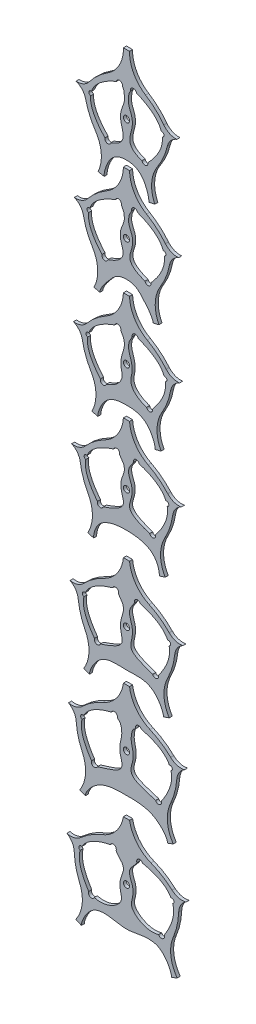
from build123d import *

# Parameters (mm, degrees)
SKETCH1_R        = 2.54
EXTRUDE1_DEPTH   = 2.54
EXTRUDE1_2_DEPTH = 2.54
EXTRUDE1_3_DEPTH = 2.54
EXTRUDE1_4_DEPTH = 2.54
EXTRUDE1_5_DEPTH = 2.54
EXTRUDE1_6_DEPTH = 2.54
EXTRUDE1_7_DEPTH = 2.54


with BuildPart() as part:
    # Sketch1 → Extrude1 (new body)
    with BuildSketch(Plane.XY):
        with BuildLine():
            Line((107.832128909, 1.131393568), (112.80266244, 2.180296049))
            ThreePointArc((112.80266244, 2.180296049), (110.202439892, 16.465021349), (114.978784208, 30.176369538))
            ThreePointArc((114.978784208, 30.176369538), (119.931057181, 39.205187012), (123.16449007, 48.982173475))
            ThreePointArc((123.16449007, 48.982173475), (125.98573059, 54.438433103), (131.070292672, 57.884792869))
            ThreePointArc((131.070292672, 57.884792869), (125.026748215, 58.982853705), (120.241431843, 62.833946332))
            ThreePointArc((120.241431843, 62.833946332), (113.333256734, 70.470808856), (105.155100681, 76.728789053))
            ThreePointArc((105.155100681, 76.728789053), (95.245871811, 87.341127032), (91.852567934, 101.458493039))
            Line((91.852567934, 101.458493039), (86.772567934, 101.458493039))
            ThreePointArc((86.772567934, 101.458493039), (83.379264056, 87.341127032), (73.470035186, 76.728789053))
            ThreePointArc((73.470035186, 76.728789053), (65.291879133, 70.470808856), (58.383704024, 62.833946332))
            ThreePointArc((58.383704024, 62.833946332), (53.598387652, 58.982853705), (47.554843195, 57.884792869))
            ThreePointArc((47.554843195, 57.884792869), (52.639405277, 54.438433103), (55.460645797, 48.982173475))
            ThreePointArc((55.460645797, 48.982173475), (58.694078686, 39.205187012), (63.646351659, 30.176369538))
            ThreePointArc((63.646351659, 30.176369538), (68.422695975, 16.465021349), (65.822473427, 2.180296049))
            Line((65.822473427, 2.180296049), (70.793006958, 1.131393568))
            add(Edge.make_bspline(
                [(70.793006958, 1.131393568), (70.520166152, 3.921097352), (74.091504837, 16.648822389), (82.215229208, 22.274663695), (89.312567934, 22.088090389)],
                knots=[0, 0, 0, 0, 0.457135888, 1, 1, 1, 1], degree=3))
            add(Edge.make_bspline(
                [(107.832128909, 1.131393568), (108.104969715, 3.921097352), (104.53363103, 16.648822389), (96.409906659, 22.274663695), (89.312567934, 22.088090389)],
                knots=[0, 0, 0, 0, 0.457135888, 1, 1, 1, 1], degree=3))
        make_face()
        with BuildLine():
            ThreePointArc((59.637889432, 53.452923121), (58.209567442, 55.601544434), (60.331376363, 57.069401428))
            Line((60.331376363, 57.069401428), (60.398343732, 57.056559931))
            add(Edge.make_bspline(
                [(60.398343732, 57.056559931), (63.674328618, 67.194658752), (81.048232702, 74.450161835)],
                knots=[0, 0, 0, 1, 1, 1], degree=2))
            ThreePointArc((81.048232702, 74.450161835), (84.057950708, 76.41097736), (86.018766233, 73.401259354))
            add(Edge.make_bspline(
                [(86.018766233, 73.401259354), (87.907895139, 69.875806798), (87.224438312, 69.342686057), (88.021949574, 59.936223688), (81.811165872, 54.675976641), (87.835939676, 37.343411453), (85.112897294, 31.001956272), (76.469615876, 28.149796174)],
                knots=[0, 0, 0, 0, 0.293254115, 0.36917198, 0.759178644, 0.846961781, 1, 1, 1, 1], degree=3))
            ThreePointArc((76.469615876, 28.149796174), (73.45989787, 26.18898065), (71.499082345, 29.198698656))
            add(Edge.make_bspline(
                [(59.637889432, 53.452923121), (58.538194712, 42.855574575), (71.499082345, 29.198698656)],
                knots=[0, 0, 0, 1, 1, 1], degree=2))
        make_face(mode=Mode.SUBTRACT)
        with Locations((89.312567934, 51.546331462)):
            Circle(SKETCH1_R, mode=Mode.SUBTRACT)
        with BuildLine():
            Line((118.226792135, 57.056559931), (118.293759504, 57.069401428))
            ThreePointArc((118.293759504, 57.069401428), (120.415568425, 55.601544434), (118.987246435, 53.452923121))
            add(Edge.make_bspline(
                [(118.987246435, 53.452923121), (120.086941155, 42.855574575), (107.126053522, 29.198698656)],
                knots=[0, 0, 0, 1, 1, 1], degree=2))
            ThreePointArc((107.126053522, 29.198698656), (105.165237997, 26.18898065), (102.155519991, 28.149796174))
            add(Edge.make_bspline(
                [(92.606369634, 73.401259354), (90.717240728, 69.875806798), (91.400697555, 69.342686057), (90.603186293, 59.936223688), (96.813969995, 54.675976641), (90.789196191, 37.343411453), (93.512238573, 31.001956272), (102.155519991, 28.149796174)],
                knots=[0, 0, 0, 0, 0.293254115, 0.36917198, 0.759178644, 0.846961781, 1, 1, 1, 1], degree=3))
            ThreePointArc((92.606369634, 73.401259354), (94.567185159, 76.41097736), (97.576903165, 74.450161835))
            add(Edge.make_bspline(
                [(118.226792135, 57.056559931), (114.950807249, 67.194658752), (97.576903165, 74.450161835)],
                knots=[0, 0, 0, 1, 1, 1], degree=2))
        make_face(mode=Mode.SUBTRACT)
    extrude(amount=EXTRUDE1_DEPTH)


with BuildPart() as body_2:
    # Sketch1 → Extrude1 2 (new body)
    with BuildSketch(Plane.XY):
        with BuildLine():
            Line((111.317801955, -83.801898793), (116.248774396, -82.580460794))
            ThreePointArc((116.248774396, -82.580460794), (113.152453729, -68.394998781), (117.448198024, -54.525567821))
            ThreePointArc((117.448198024, -54.525567821), (122.08290251, -45.329695547), (124.973744359, -35.445992498))
            ThreePointArc((124.973744359, -35.445992498), (127.603177249, -29.894753909), (132.564582131, -26.273341368))
            ThreePointArc((132.564582131, -26.273341368), (126.486450449, -25.386502911), (121.569867972, -21.704467611))
            ThreePointArc((121.569867972, -21.704467611), (114.399820133, -14.312920646), (106.008602299, -8.34366476))
            ThreePointArc((106.008602299, -8.34366476), (95.735657697, 1.916995227), (91.852567934, 15.907568771))
            Line((91.852567934, 15.907568771), (86.772567934, 15.907568771))
            ThreePointArc((86.772567934, 15.907568771), (82.88947817, 1.916995227), (72.616533568, -8.34366476))
            ThreePointArc((72.616533568, -8.34366476), (64.225315734, -14.312920646), (57.055267895, -21.704467611))
            ThreePointArc((57.055267895, -21.704467611), (52.138685418, -25.386502911), (46.060553736, -26.273341368))
            ThreePointArc((46.060553736, -26.273341368), (51.021958618, -29.894753909), (53.651391508, -35.445992498))
            ThreePointArc((53.651391508, -35.445992498), (56.542233357, -45.329695547), (61.176937843, -54.525567821))
            ThreePointArc((61.176937843, -54.525567821), (65.472682138, -68.394998781), (62.376361471, -82.580460794))
            Line((62.376361471, -82.580460794), (67.307333912, -83.801898793))
            add(Edge.make_bspline(
                [(67.307333912, -83.801898793), (67.034493107, -81.012195009), (76.161181326, -69.268831123), (82.215229208, -63.276260573), (89.312567934, -63.462833879)],
                knots=[0, 0, 0, 0, 0.457135888, 1, 1, 1, 1], degree=3))
            add(Edge.make_bspline(
                [(111.317801955, -83.801898793), (111.59064276, -81.012195009), (102.463954541, -69.268831123), (96.409906659, -63.276260573), (89.312567934, -63.462833879)],
                knots=[0, 0, 0, 0, 0.457135888, 1, 1, 1, 1], degree=3))
        make_face()
        with BuildLine():
            ThreePointArc((57.981859116, -31.123491246), (56.629261739, -28.926411915), (58.800922347, -27.533369397))
            Line((58.800922347, -27.533369397), (58.867401666, -27.548536227))
            add(Edge.make_bspline(
                [(58.867401666, -27.548536227), (62.494606868, -17.53072673), (80.110743569, -10.884931381)],
                knots=[0, 0, 0, 1, 1, 1], degree=2))
            ThreePointArc((80.110743569, -10.884931381), (83.186948789, -9.03016416), (85.04171601, -12.10636938))
            add(Edge.make_bspline(
                [(85.04171601, -12.10636938), (86.930844917, -15.631821935), (87.288646986, -16.209612947), (87.954533792, -25.614071063), (81.145621359, -30.768735871), (88.454678543, -48.305670405), (82.565093241, -54.14551048), (73.921811823, -56.997670578)],
                knots=[0, 0, 0, 0, 0.293254115, 0.36917198, 0.759178644, 0.846961781, 1, 1, 1, 1], degree=3))
            ThreePointArc((73.921811823, -56.997670578), (70.845606603, -58.852437799), (68.990839382, -55.776232579))
            add(Edge.make_bspline(
                [(57.981859116, -31.123491246), (56.513622718, -41.676093132), (68.990839382, -55.776232579)],
                knots=[0, 0, 0, 1, 1, 1], degree=2))
        make_face(mode=Mode.SUBTRACT)
        with Locations((89.312567934, -34.004592806)):
            Circle(SKETCH1_R, mode=Mode.SUBTRACT)
        with BuildLine():
            Line((119.757734201, -27.548536227), (119.82421352, -27.533369397))
            ThreePointArc((119.82421352, -27.533369397), (121.995874128, -28.926411915), (120.643276751, -31.123491246))
            add(Edge.make_bspline(
                [(120.643276751, -31.123491246), (122.111513149, -41.676093132), (109.634296485, -55.776232579)],
                knots=[0, 0, 0, 1, 1, 1], degree=2))
            ThreePointArc((109.634296485, -55.776232579), (107.779529264, -58.852437799), (104.703324044, -56.997670578))
            add(Edge.make_bspline(
                [(93.583419857, -12.10636938), (91.69429095, -15.631821935), (91.336488881, -16.209612947), (90.670602075, -25.614071063), (97.479514508, -30.768735871), (90.170457324, -48.305670405), (96.060042626, -54.14551048), (104.703324044, -56.997670578)],
                knots=[0, 0, 0, 0, 0.293254115, 0.36917198, 0.759178644, 0.846961781, 1, 1, 1, 1], degree=3))
            ThreePointArc((93.583419857, -12.10636938), (95.438187078, -9.03016416), (98.514392298, -10.884931381))
            add(Edge.make_bspline(
                [(119.757734201, -27.548536227), (116.130528999, -17.53072673), (98.514392298, -10.884931381)],
                knots=[0, 0, 0, 1, 1, 1], degree=2))
        make_face(mode=Mode.SUBTRACT)
    extrude(amount=EXTRUDE1_2_DEPTH)


with BuildPart() as body_3:
    # Sketch1 → Extrude1 3 (new body)
    with BuildSketch(Plane.XY):
        with BuildLine():
            Line((113.055007459, -173.708992761), (117.963911856, -172.401683458))
            ThreePointArc((117.963911856, -172.401683458), (114.620492326, -158.272420207), (118.673527412, -144.330130553))
            ThreePointArc((118.673527412, -144.330130553), (123.147035909, -135.054772108), (125.864943067, -125.122122248))
            ThreePointArc((125.864943067, -125.122122248), (128.397093009, -119.525839208), (133.294539882, -115.818389771))
            ThreePointArc((133.294539882, -115.818389771), (127.201856463, -115.037764409), (122.221762429, -111.442096096))
            ThreePointArc((122.221762429, -111.442096096), (114.923806341, -104.176809489), (106.429688651, -98.354909694))
            ThreePointArc((106.429688651, -98.354909694), (95.979235459, -88.275100059), (91.852567934, -74.354426608))
            Line((91.852567934, -74.354426608), (86.772567934, -74.354426608))
            ThreePointArc((86.772567934, -74.354426608), (82.645900408, -88.275100059), (72.195447216, -98.354909694))
            ThreePointArc((72.195447216, -98.354909694), (63.701329526, -104.176809489), (56.403373438, -111.442096096))
            ThreePointArc((56.403373438, -111.442096096), (51.423279404, -115.037764409), (45.330595985, -115.818389771))
            ThreePointArc((45.330595985, -115.818389771), (50.228042858, -119.525839208), (52.7601928, -125.122122248))
            ThreePointArc((52.7601928, -125.122122248), (55.478099958, -135.054772108), (59.951608455, -144.330130553))
            ThreePointArc((59.951608455, -144.330130553), (64.004643541, -158.272420207), (60.661224011, -172.401683458))
            Line((60.661224011, -172.401683458), (65.570128408, -173.708992761))
            add(Edge.make_bspline(
                [(65.570128408, -173.708992761), (65.297287603, -170.919288977), (70.669566244, -156.160043966), (82.215229208, -153.538255952), (89.312567934, -153.724829258)],
                knots=[0, 0, 0, 0, 0.457135888, 1, 1, 1, 1], degree=3))
            add(Edge.make_bspline(
                [(113.055007459, -173.708992761), (113.327848264, -170.919288977), (107.955569623, -156.160043966), (96.409906659, -153.538255952), (89.312567934, -153.724829258)],
                knots=[0, 0, 0, 0, 0.457135888, 1, 1, 1, 1], degree=3))
        make_face()
        with BuildLine():
            ThreePointArc((57.165438906, -120.875856415), (55.851391857, -118.655505631), (58.047033655, -117.300575983))
            Line((58.047033655, -117.300575983), (58.113238151, -117.316900727))
            add(Edge.make_bspline(
                [(58.113238151, -117.316900727), (61.914725796, -107.363920451), (79.644164595, -101.026581266)],
                knots=[0, 0, 0, 1, 1, 1], degree=2))
            ThreePointArc((79.644164595, -101.026581266), (82.752271446, -99.225783719), (84.553068993, -102.333890569))
            add(Edge.make_bspline(
                [(84.553068993, -102.333890569), (86.442197899, -105.859343124), (87.355553475, -106.512811497), (87.865027924, -115.811254425), (82.628053526, -123.038711024), (87.090334203, -136.716381264), (81.294678605, -144.172125419), (72.651397187, -147.024285517)],
                knots=[0, 0, 0, 0, 0.293254115, 0.36917198, 0.759178644, 0.846961781, 1, 1, 1, 1], degree=3))
            ThreePointArc((72.651397187, -147.024285517), (69.543290336, -148.825083064), (67.742492789, -145.716976214))
            add(Edge.make_bspline(
                [(57.165438906, -120.875856415), (55.51325783, -131.40122683), (67.742492789, -145.716976214)],
                knots=[0, 0, 0, 1, 1, 1], degree=2))
        make_face(mode=Mode.SUBTRACT)
        with Locations((89.312567934, -124.266588185)):
            Circle(SKETCH1_R, mode=Mode.SUBTRACT)
        with BuildLine():
            Line((120.511897716, -117.316900727), (120.578102212, -117.300575983))
            ThreePointArc((120.578102212, -117.300575983), (122.77374401, -118.655505631), (121.459696961, -120.875856415))
            add(Edge.make_bspline(
                [(121.459696961, -120.875856415), (123.111878037, -131.40122683), (110.882643078, -145.716976214)],
                knots=[0, 0, 0, 1, 1, 1], degree=2))
            ThreePointArc((110.882643078, -145.716976214), (109.081845531, -148.825083064), (105.97373868, -147.024285517))
            add(Edge.make_bspline(
                [(94.072066874, -102.333890569), (92.182937968, -105.859343124), (91.269582392, -106.512811497), (90.760107943, -115.811254425), (95.997082341, -123.038711024), (91.534801664, -136.716381264), (97.330457262, -144.172125419), (105.97373868, -147.024285517)],
                knots=[0, 0, 0, 0, 0.293254115, 0.36917198, 0.759178644, 0.846961781, 1, 1, 1, 1], degree=3))
            ThreePointArc((94.072066874, -102.333890569), (95.872864421, -99.225783719), (98.980971272, -101.026581266))
            add(Edge.make_bspline(
                [(120.511897716, -117.316900727), (116.710410071, -107.363920451), (98.980971272, -101.026581266)],
                knots=[0, 0, 0, 1, 1, 1], degree=2))
        make_face(mode=Mode.SUBTRACT)
    extrude(amount=EXTRUDE1_3_DEPTH)


with BuildPart() as body_4:
    # Sketch1 → Extrude1 4 (new body)
    with BuildSketch(Plane.XY):
        with BuildLine():
            Line((116.503626903, -262.696328621), (121.364004788, -261.218787822))
            ThreePointArc((121.364004788, -261.218787822), (117.53035459, -247.214586298), (121.095182818, -233.13955401))
            ThreePointArc((121.095182818, -233.13955401), (125.242824049, -223.713970486), (127.613029858, -213.692659345))
            ThreePointArc((127.613029858, -213.692659345), (129.94866929, -208.011554202), (134.713976252, -204.135729547))
            ThreePointArc((134.713976252, -204.135729547), (128.597794821, -203.567845844), (123.495451856, -200.147865804))
            ThreePointArc((123.495451856, -200.147865804), (115.948805294, -193.141249058), (107.257010585, -187.618816868))
            ThreePointArc((107.257010585, -187.618816868), (96.461723403, -177.909218069), (91.852567934, -164.1407679))
            Line((91.852567934, -164.1407679), (86.772567934, -164.1407679))
            ThreePointArc((86.772567934, -164.1407679), (82.163412464, -177.909218069), (71.368125282, -187.618816868))
            ThreePointArc((71.368125282, -187.618816868), (62.676330573, -193.141249058), (55.129684011, -200.147865804))
            ThreePointArc((55.129684011, -200.147865804), (50.027341046, -203.567845844), (43.911159615, -204.135729547))
            ThreePointArc((43.911159615, -204.135729547), (48.676466577, -208.011554202), (51.012106009, -213.692659345))
            ThreePointArc((51.012106009, -213.692659345), (53.382311818, -223.713970486), (57.529953049, -233.13955401))
            ThreePointArc((57.529953049, -233.13955401), (61.094781277, -247.214586298), (57.261131079, -261.218787822))
            Line((57.261131079, -261.218787822), (62.121508964, -262.696328621))
            add(Edge.make_bspline(
                [(62.121508964, -262.696328621), (61.848668159, -259.906624837), (65.058750413, -245.89938072), (82.215229208, -243.324597244), (89.312567934, -243.51117055)],
                knots=[0, 0, 0, 0, 0.457135888, 1, 1, 1, 1], degree=3))
            add(Edge.make_bspline(
                [(116.503626903, -262.696328621), (116.776467708, -259.906624837), (113.566385454, -245.89938072), (96.409906659, -243.324597244), (89.312567934, -243.51117055)],
                knots=[0, 0, 0, 0, 0.457135888, 1, 1, 1, 1], degree=3))
        make_face()
        with BuildLine():
            ThreePointArc((55.562616704, -209.60244918), (54.326723931, -207.337665236), (56.56823823, -206.06005383))
            Line((56.56823823, -206.06005383), (56.633833783, -206.078675213))
            add(Edge.make_bspline(
                [(56.633833783, -206.078675213), (60.779773227, -196.264180279), (78.719240175, -190.548378171)],
                knots=[0, 0, 0, 1, 1, 1], degree=2))
            ThreePointArc((78.719240175, -190.548378171), (81.888199517, -188.856959628), (83.57961806, -192.02591897))
            add(Edge.make_bspline(
                [(83.57961806, -192.02591897), (85.468746966, -195.551371525), (87.417103619, -196.255535263), (87.801743966, -205.670963239), (81.838599812, -210.161824822), (89.011837768, -228.639472241), (78.771449525, -233.422371128), (70.128168107, -236.274531225)],
                knots=[0, 0, 0, 0, 0.293254115, 0.36917198, 0.759178644, 0.846961781, 1, 1, 1, 1], degree=3))
            ThreePointArc((70.128168107, -236.274531225), (66.959208765, -237.965949769), (65.267790222, -234.796990427))
            add(Edge.make_bspline(
                [(55.562616704, -209.60244918), (53.54473706, -220.063868129), (65.267790222, -234.796990427)],
                knots=[0, 0, 0, 1, 1, 1], degree=2))
        make_face(mode=Mode.SUBTRACT)
        with Locations((89.312567934, -214.052929476)):
            Circle(SKETCH1_R, mode=Mode.SUBTRACT)
        with BuildLine():
            Line((121.991302084, -206.078675213), (122.056897637, -206.06005383))
            ThreePointArc((122.056897637, -206.06005383), (124.298411936, -207.337665236), (123.062519163, -209.60244918))
            add(Edge.make_bspline(
                [(123.062519163, -209.60244918), (125.080398807, -220.063868129), (113.357345645, -234.796990427)],
                knots=[0, 0, 0, 1, 1, 1], degree=2))
            ThreePointArc((113.357345645, -234.796990427), (111.665927102, -237.965949769), (108.49696776, -236.274531225))
            add(Edge.make_bspline(
                [(95.045517807, -192.02591897), (93.156388901, -195.551371525), (91.208032248, -196.255535263), (90.823391901, -205.670963239), (96.786536055, -210.161824822), (89.613298099, -228.639472241), (99.853686342, -233.422371128), (108.49696776, -236.274531225)],
                knots=[0, 0, 0, 0, 0.293254115, 0.36917198, 0.759178644, 0.846961781, 1, 1, 1, 1], degree=3))
            ThreePointArc((95.045517807, -192.02591897), (96.73693635, -188.856959628), (99.905895692, -190.548378171))
            add(Edge.make_bspline(
                [(121.991302084, -206.078675213), (117.84536264, -196.264180279), (99.905895692, -190.548378171)],
                knots=[0, 0, 0, 1, 1, 1], degree=2))
        make_face(mode=Mode.SUBTRACT)
    extrude(amount=EXTRUDE1_4_DEPTH)


with BuildPart() as body_5:
    # Sketch1 → Extrude1 5 (new body)
    with BuildSketch(Plane.XY):
        with BuildLine():
            Line((119.922315554, -362.104758585), (124.728265559, -360.45878029))
            ThreePointArc((124.728265559, -360.45878029), (120.40903943, -346.596644097), (123.48133246, -332.405958781))
            ThreePointArc((123.48133246, -332.405958781), (127.298070446, -322.841594521), (129.317697054, -312.743789764))
            ThreePointArc((129.317697054, -312.743789764), (131.453990091, -306.984760396), (136.081371207, -302.945266467))
            ThreePointArc((136.081371207, -302.945266467), (129.949117902, -302.590813935), (124.730721164, -299.350674635))
            ThreePointArc((124.730721164, -299.350674635), (116.944547105, -292.611235038), (108.06562877, -287.394975673))
            ThreePointArc((108.06562877, -287.394975673), (96.938615007, -278.067376898), (91.852567934, -264.467867371))
            Line((91.852567934, -264.467867371), (86.772567934, -264.467867371))
            ThreePointArc((86.772567934, -264.467867371), (81.68652086, -278.067376898), (70.559507097, -287.394975673))
            ThreePointArc((70.559507097, -287.394975673), (61.680588762, -292.611235038), (53.894414703, -299.350674635))
            ThreePointArc((53.894414703, -299.350674635), (48.676017965, -302.590813935), (42.54376466, -302.945266467))
            ThreePointArc((42.54376466, -302.945266467), (47.171145776, -306.984760396), (49.307438813, -312.743789764))
            ThreePointArc((49.307438813, -312.743789764), (51.327065421, -322.841594521), (55.143803407, -332.405958781))
            ThreePointArc((55.143803407, -332.405958781), (58.216096437, -346.596644097), (53.896870308, -360.45878029))
            Line((53.896870308, -360.45878029), (58.702820313, -362.104758585))
            add(Edge.make_bspline(
                [(58.702820313, -362.104758585), (58.429979508, -359.315054801), (66.941913641, -341.653320457), (82.215229208, -343.651696715), (89.312567934, -343.838270021)],
                knots=[0, 0, 0, 0, 0.457135888, 1, 1, 1, 1], degree=3))
            add(Edge.make_bspline(
                [(119.922315554, -362.104758585), (120.195156359, -359.315054801), (111.683222226, -341.653320457), (96.409906659, -343.651696715), (89.312567934, -343.838270021)],
                knots=[0, 0, 0, 0, 0.457135888, 1, 1, 1, 1], degree=3))
        make_face()
        with BuildLine():
            ThreePointArc((53.997688963, -308.814601513), (52.841451062, -306.508134264), (55.126116261, -305.309392346))
            Line((55.126116261, -305.309392346), (55.191023227, -305.330287759))
            add(Edge.make_bspline(
                [(55.191023227, -305.330287759), (59.676380559, -295.666194719), (77.804093934, -290.578869695)],
                knots=[0, 0, 0, 1, 1, 1], degree=2))
            ThreePointArc((77.804093934, -290.578869695), (81.030058084, -288.99888384), (82.610043939, -292.22484799))
            add(Edge.make_bspline(
                [(82.610043939, -292.22484799), (84.499172845, -295.750300546), (86.674012285, -296.999383868), (86.971319517, -306.323168758), (82.166141642, -311.000416605), (87.568643472, -328.794653473), (76.268429724, -333.125791728), (67.625148306, -335.977951826)],
                knots=[0, 0, 0, 0, 0.293254115, 0.36917198, 0.759178644, 0.846961781, 1, 1, 1, 1], degree=3))
            ThreePointArc((67.625148306, -335.977951826), (64.399184156, -337.557937681), (62.819198301, -334.331973531))
            add(Edge.make_bspline(
                [(53.997688963, -308.814601513), (51.616560819, -319.199366963), (62.819198301, -334.331973531)],
                knots=[0, 0, 0, 1, 1, 1], degree=2))
        make_face(mode=Mode.SUBTRACT)
        with Locations((89.312567934, -312.727867371)):
            Circle(SKETCH1_R, mode=Mode.SUBTRACT)
        with BuildLine():
            Line((123.43411264, -305.330287759), (123.499019606, -305.309392346))
            ThreePointArc((123.499019606, -305.309392346), (125.783684805, -306.508134264), (124.627446904, -308.814601513))
            add(Edge.make_bspline(
                [(124.627446904, -308.814601513), (127.008575048, -319.199366963), (115.805937566, -334.331973531)],
                knots=[0, 0, 0, 1, 1, 1], degree=2))
            ThreePointArc((115.805937566, -334.331973531), (114.225951711, -337.557937681), (110.999987561, -335.977951826))
            add(Edge.make_bspline(
                [(96.015091928, -292.22484799), (94.125963022, -295.750300546), (91.951123582, -296.999383868), (91.65381635, -306.323168758), (96.458994225, -311.000416605), (91.056492395, -328.794653473), (102.356706143, -333.125791728), (110.999987561, -335.977951826)],
                knots=[0, 0, 0, 0, 0.293254115, 0.36917198, 0.759178644, 0.846961781, 1, 1, 1, 1], degree=3))
            ThreePointArc((96.015091928, -292.22484799), (97.595077783, -288.99888384), (100.821041933, -290.578869695))
            add(Edge.make_bspline(
                [(123.43411264, -305.330287759), (118.948755308, -295.666194719), (100.821041933, -290.578869695)],
                knots=[0, 0, 0, 1, 1, 1], degree=2))
        make_face(mode=Mode.SUBTRACT)
    extrude(amount=EXTRUDE1_5_DEPTH)


with BuildPart() as body_6:
    # Sketch1 → Extrude1 6 (new body)
    with BuildSketch(Plane.XY):
        with BuildLine():
            Line((123.312694585, -451.072060939), (128.058273121, -449.259360093))
            ThreePointArc((128.058273121, -449.259360093), (123.257896571, -435.556407157), (125.833070268, -421.267144943))
            ThreePointArc((125.833070268, -421.267144943), (129.313691702, -411.5754048), (130.979679704, -401.4132674))
            ThreePointArc((130.979679704, -401.4132674), (132.913684142, -395.583190726), (137.397270078, -391.384664275))
            ThreePointArc((137.397270078, -391.384664275), (131.256382161, -391.24444022), (125.928085098, -388.188394145))
            ThreePointArc((125.928085098, -388.188394145), (117.911451116, -381.724793589), (108.855896752, -376.821581609))
            ThreePointArc((108.855896752, -376.821581609), (97.410132763, -367.887992135), (91.852567933, -354.474267546))
            Line((91.852567934, -354.474267546), (86.772567934, -354.474267546))
            ThreePointArc((86.772567934, -354.474267546), (81.215003104, -367.887992135), (69.769239115, -376.821581609))
            ThreePointArc((69.769239115, -376.821581609), (60.713684751, -381.724793589), (52.697050769, -388.188394145))
            ThreePointArc((52.697050769, -388.188394145), (47.368753706, -391.24444022), (41.227865789, -391.384664275))
            ThreePointArc((41.227865789, -391.384664275), (45.711451725, -395.583190726), (47.645456163, -401.4132674))
            ThreePointArc((47.645456163, -401.4132674), (49.311444165, -411.5754048), (52.792065599, -421.267144943))
            ThreePointArc((52.792065599, -421.267144943), (55.367239296, -435.556407157), (50.566862746, -449.259360093))
            Line((50.566862746, -449.259360093), (55.312441282, -451.072060939))
            add(Edge.make_bspline(
                [(55.312441282, -451.072060939), (55.039600477, -448.282357155), (65.322964887, -433.899682536), (82.215229208, -433.65809689), (89.312567934, -433.844670196)],
                knots=[0, 0, 0, 0, 0.457135888, 1, 1, 1, 1], degree=3))
            add(Edge.make_bspline(
                [(123.312694585, -451.072060939), (123.58553539, -448.282357155), (113.30217098, -433.899682536), (96.409906659, -433.65809689), (89.312567934, -433.844670196)],
                knots=[0, 0, 0, 0, 0.457135888, 1, 1, 1, 1], degree=3))
        make_face()
        with BuildLine():
            ThreePointArc((52.469975832, -397.650160075), (51.394936826, -395.304745742), (53.720045758, -394.186467732))
            Line((53.720045758, -394.186467732), (53.784183945, -394.209615636))
            add(Edge.make_bspline(
                [(53.784183945, -394.209615636), (58.604080902, -384.707946414), (76.898296447, -380.256368524)],
                knots=[0, 0, 0, 1, 1, 1], degree=2))
            ThreePointArc((76.898296447, -380.256368524), (80.177436138, -378.789929679), (81.643874983, -382.06906937))
            add(Edge.make_bspline(
                [(81.643874983, -382.06906937), (84.383406378, -383.393541368), (85.217415015, -386.911265454), (85.675186648, -395.279630642), (82.234913218, -401.205431618), (85.562764927, -411.262171298), (86.246923161, -419.565395129), (73.784427858, -422.420394583), (65.14114644, -425.272554681)],
                knots=[0, 0, 0, 0, 0.280226495, 0.352771759, 0.684043649, 0.735460314, 0.825529427, 1, 1, 1, 1], degree=3))
            ThreePointArc((65.14114644, -425.272554681), (61.862006749, -426.738993526), (60.395567904, -423.459853835))
            add(Edge.make_bspline(
                [(52.469975832, -397.650160075), (49.727875119, -407.945499232), (60.395567904, -423.459853835)],
                knots=[0, 0, 0, 1, 1, 1], degree=2))
        make_face(mode=Mode.SUBTRACT)
        with Locations((89.312567934, -401.846429122)):
            Circle(SKETCH1_R, mode=Mode.SUBTRACT)
        with BuildLine():
            Line((124.840951922, -394.209615636), (124.905090109, -394.186467732))
            ThreePointArc((124.905090109, -394.186467732), (127.230199041, -395.304745742), (126.155160035, -397.650160075))
            add(Edge.make_bspline(
                [(126.155160035, -397.650160075), (128.897260748, -407.945499232), (118.229567963, -423.459853835)],
                knots=[0, 0, 0, 1, 1, 1], degree=2))
            ThreePointArc((118.229567963, -423.459853835), (116.763129118, -426.738993526), (113.483989427, -425.272554681))
            add(Edge.make_bspline(
                [(96.981260884, -382.06906937), (94.241729489, -383.393541368), (93.407720852, -386.911265454), (92.949949219, -395.279630642), (96.390222649, -401.205431618), (93.06237094, -411.262171298), (92.378212706, -419.565395129), (104.840708009, -422.420394583), (113.483989427, -425.272554681)],
                knots=[0, 0, 0, 0, 0.280226495, 0.352771759, 0.684043649, 0.735460314, 0.825529427, 1, 1, 1, 1], degree=3))
            ThreePointArc((96.981260884, -382.06906937), (98.447699729, -378.789929679), (101.72683942, -380.256368524))
            add(Edge.make_bspline(
                [(124.840951922, -394.209615636), (120.021054965, -384.707946414), (101.72683942, -380.256368524)],
                knots=[0, 0, 0, 1, 1, 1], degree=2))
        make_face(mode=Mode.SUBTRACT)
    extrude(amount=EXTRUDE1_6_DEPTH)


with BuildPart() as body_7:
    # Sketch1 → Extrude1 7 (new body)
    with BuildSketch(Plane.XY):
        with BuildLine():
            Line((126.670447131, -545.786777039), (131.349754289, -543.809282533))
            ThreePointArc((131.349754289, -543.809282533), (126.073267563, -530.282523053), (128.147325793, -515.911969249))
            ThreePointArc((128.147325793, -515.911969249), (131.28700405, -506.104473493), (132.596713371, -495.890306172))
            ThreePointArc((132.596713371, -495.890306172), (134.325720735, -489.996181917), (138.659788852, -485.643479221))
            ThreePointArc((138.659788852, -485.643479221), (132.517752492, -485.71802149), (127.085875438, -482.850116528))
            ThreePointArc((127.085875438, -482.850116528), (118.848179314, -476.670722131), (109.626747815, -472.087082346))
            ThreePointArc((109.626747815, -472.087082346), (97.875668904, -463.559088524), (91.852567933, -450.347851304))
            Line((91.852567934, -450.347851304), (86.772567934, -450.347851304))
            ThreePointArc((86.772567934, -450.347851304), (80.749466963, -463.559088524), (68.998388052, -472.087082346))
            ThreePointArc((68.998388052, -472.087082346), (59.776956553, -476.670722131), (51.539260429, -482.850116528))
            ThreePointArc((51.539260429, -482.850116528), (46.107383375, -485.71802149), (39.965347015, -485.643479221))
            ThreePointArc((39.965347015, -485.643479221), (44.299415132, -489.996181917), (46.028422496, -495.890306172))
            ThreePointArc((46.028422496, -495.890306172), (47.338131817, -506.104473493), (50.477810074, -515.911969249))
            ThreePointArc((50.477810074, -515.911969249), (52.551868304, -530.282523053), (47.275381578, -543.809282533))
            Line((47.275381578, -543.809282533), (51.954688736, -545.786777039))
            add(Edge.make_bspline(
                [(51.954688736, -545.786777039), (51.68184793, -542.997073255), (61.05557943, -521.144702459), (82.044820089, -529.834323489), (89.312567934, -529.718253954)],
                knots=[0, 0, 0, 0, 0.457135888, 1, 1, 1, 1], degree=3))
            add(Edge.make_bspline(
                [(126.670447131, -545.786777039), (126.943287937, -542.997073255), (117.569556437, -521.144702459), (96.580315778, -529.834323489), (89.312567934, -529.718253954)],
                knots=[0, 0, 0, 0, 0.457135888, 1, 1, 1, 1], degree=3))
        make_face()
        with BuildLine():
            ThreePointArc((50.981548401, -492.298160496), (49.989160363, -489.916597304), (52.351942168, -488.880286831))
            Line((52.351942168, -488.880286831), (52.415231918, -488.905662807))
            add(Edge.make_bspline(
                [(52.415231918, -488.905662807), (57.564353545, -479.578301382), (76.003010227, -475.768995949)],
                knots=[0, 0, 0, 1, 1, 1], degree=2))
            ThreePointArc((76.003010227, -475.768995949), (79.331411059, -474.418089623), (80.682317384, -477.746490455))
            add(Edge.make_bspline(
                [(80.682317384, -477.746490455), (82.57144629, -481.271943011), (86.814696495, -483.557330486), (86.815859764, -492.734754469), (81.5834326, -497.153806766), (87.16589542, -514.332448725), (71.867596695, -523.159569295), (62.679316441, -520.346644791)],
                knots=[0, 0, 0, 0, 0.293254115, 0.36917198, 0.759178644, 0.846961781, 1, 1, 1, 1], degree=3))
            ThreePointArc((62.679316441, -520.346644791), (59.350915609, -521.697551116), (58.000009283, -518.369150284))
            add(Edge.make_bspline(
                [(50.981548401, -492.298160496), (47.881206866, -502.49134484), (58.000009283, -518.369150284)],
                knots=[0, 0, 0, 1, 1, 1], degree=2))
        make_face(mode=Mode.SUBTRACT)
        with Locations((89.312567934, -497.72001288)):
            Circle(SKETCH1_R, mode=Mode.SUBTRACT)
        with BuildLine():
            Line((126.209903949, -488.905662807), (126.273193699, -488.880286831))
            ThreePointArc((126.273193699, -488.880286831), (128.635975504, -489.916597304), (127.643587466, -492.298160496))
            add(Edge.make_bspline(
                [(127.643587466, -492.298160496), (130.743929001, -502.49134484), (120.625126584, -518.369150284)],
                knots=[0, 0, 0, 1, 1, 1], degree=2))
            ThreePointArc((120.625126584, -518.369150284), (119.274220258, -521.697551116), (115.945819426, -520.346644791))
            add(Edge.make_bspline(
                [(97.942818483, -477.746490455), (96.053689577, -481.271943011), (91.810439372, -483.557330486), (91.809276103, -492.734754469), (97.041703267, -497.153806766), (91.459240447, -514.332448725), (106.757539172, -523.159569295), (115.945819426, -520.346644791)],
                knots=[0, 0, 0, 0, 0.293254115, 0.36917198, 0.759178644, 0.846961781, 1, 1, 1, 1], degree=3))
            ThreePointArc((97.942818483, -477.746490455), (99.293724808, -474.418089623), (102.62212564, -475.768995949))
            add(Edge.make_bspline(
                [(126.209903949, -488.905662807), (121.060782322, -479.578301382), (102.62212564, -475.768995949)],
                knots=[0, 0, 0, 1, 1, 1], degree=2))
        make_face(mode=Mode.SUBTRACT)
    extrude(amount=EXTRUDE1_7_DEPTH)


solid = Compound([part.part, body_2.part, body_3.part, body_4.part, body_5.part, body_6.part, body_7.part])
